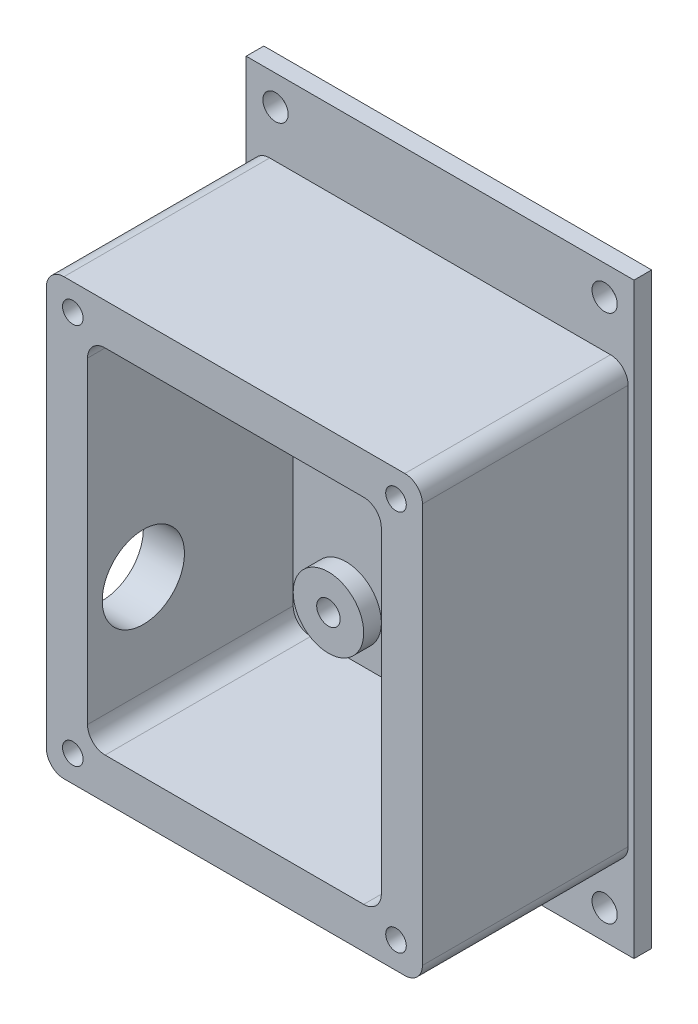
from build123d import *

# Parameters (mm, degrees)
SKICA1_W                    = 50
SKICA1_H                    = 60
P_IDAT_VYSUNUT_M2_DEPTH     = 3
SKICA3_W                    = 64
SKICA3_H                    = 74
SKICA3_W_2                  = 50
SKICA3_H_2                  = 60
VYSUNOUT_TENKOST_NN_1_DEPTH = 35
SKICA4_W                    = 66
SKICA4_H                    = 100
SKICA4_R                    = 2.15
SKICA4_W_2                  = 50
SKICA4_H_2                  = 60
P_IDAT_VYSUNUT_M5_DEPTH     = 3
SKICA2_R                    = 6
SKICA2_R_2                  = 2
VYSUNOUT_TENKOST_NN_2_DEPTH = 3
ZAOBLIT2_R                  = 3
ODEBRAT_VYSUNUT_M3_REACH    = 107.868
SKICA9_R                    = 7
ZAOBLIT4_R                  = 3
ZAOBLIT5_R                  = 3
ZAOBLIT6_R                  = 3
ZAOBLIT7_R                  = 3
SKICA10_R                   = 1.75
ODEBRAT_VYSUNUT_M4_DEPTH    = 30


with BuildPart() as part:
    # Skica1 → Přidat vysunutím2 (new body)
    with BuildSketch(Plane.XY):
        with Locations((25, 30)):
            Rectangle(SKICA1_W, SKICA1_H)
    extrude(amount=P_IDAT_VYSUNUT_M2_DEPTH)



with BuildPart() as body_2:
    # Skica3 → Vysunout tenkostěnný1 (new body)
    with BuildSketch(Plane.XY.offset(3)):
        with Locations((25, 30)):
            Rectangle(SKICA3_W, SKICA3_H)
        with Locations((25, 30)):
            Rectangle(SKICA3_W_2, SKICA3_H_2, mode=Mode.SUBTRACT)
    extrude(amount=VYSUNOUT_TENKOST_NN_1_DEPTH)


with BuildPart() as part_1:
    add(part.part)

    add(body_2.part)  # Přidat vysunutím5 merges body 2
    # Skica4 → Přidat vysunutím5 (add)
    with BuildSketch(Plane(origin=(0, 0, 0), x_dir=(-1, 0, 0), z_dir=(0, 0, -1))):
        with Locations((-25, 30)):
            Rectangle(SKICA4_W, SKICA4_H)
        with Locations((-53, 75)):
            Circle(SKICA4_R, mode=Mode.SUBTRACT)
        with Locations((3, 75)):
            Circle(SKICA4_R, mode=Mode.SUBTRACT)
        with Locations((3, -15)):
            Circle(SKICA4_R, mode=Mode.SUBTRACT)
        with Locations((-53, -15)):
            Circle(SKICA4_R, mode=Mode.SUBTRACT)
        with Locations((-25, 30)):
            Rectangle(SKICA4_W_2, SKICA4_H_2, mode=Mode.SUBTRACT)
    extrude(amount=-P_IDAT_VYSUNUT_M5_DEPTH)

    # Skica2 → Vysunout tenkostěnný2 (add)
    # profile 1 of 4: a face of its own
    with BuildSketch(Plane.XY.offset(3)):
        with Locations((9, 53)):
            Circle(SKICA2_R)
        with Locations((9, 53)):
            Circle(SKICA2_R_2, mode=Mode.SUBTRACT)
    # profile 2 of 4: a face of its own
    with BuildSketch(Plane.XY.offset(3)):
        with Locations((35, 53)):
            Circle(SKICA2_R)
        with Locations((35, 53)):
            Circle(SKICA2_R_2, mode=Mode.SUBTRACT)
    # profile 3 of 4: a face of its own
    with BuildSketch(Plane.XY.offset(3)):
        with Locations((35, 8)):
            Circle(SKICA2_R)
        with Locations((35, 8)):
            Circle(SKICA2_R_2, mode=Mode.SUBTRACT)
    # profile 4 of 4: a face of its own
    with BuildSketch(Plane.XY.offset(3)):
        with Locations((9, 8)):
            Circle(SKICA2_R)
        with Locations((9, 8)):
            Circle(SKICA2_R_2, mode=Mode.SUBTRACT)
    extrude(amount=VYSUNOUT_TENKOST_NN_2_DEPTH)

    # Zaoblit2
    zaoblit2_edges = [part_1.edges().sort_by_distance(p)[0] for p in [
        (-7, 67, 20.5),
        (-7, -7, 20.5),
        (57, -7, 20.5),
        (57, 67, 20.5),
    ]]
    fillet(zaoblit2_edges, radius=ZAOBLIT2_R)

    # Skica9 → Odebrat vysunutím3 (cut, up to next)
    with BuildSketch(Plane(origin=(0, 0, 0), x_dir=(0, 0, -1), z_dir=(1, 0, 0)), mode=Mode.PRIVATE) as odebrat_vysunut_m3_sk1:
        with Locations((-28.5, 20)):
            Circle(SKICA9_R)
    odebrat_vysunut_m3_tool1 = extrude(odebrat_vysunut_m3_sk1.sketch, amount=-ODEBRAT_VYSUNUT_M3_REACH, mode=Mode.PRIVATE) & part_1.part
    add(odebrat_vysunut_m3_tool1.solids().sort_by_distance((0, 20, 28.5))[0], mode=Mode.SUBTRACT)

    # Zaoblit4
    zaoblit4_edges = [part_1.edges().sort_by_distance(p)[0] for p in [
        (50, 60, 20.5),
    ]]
    fillet(zaoblit4_edges, radius=ZAOBLIT4_R)

    # Zaoblit5
    zaoblit5_edges = [part_1.edges().sort_by_distance(p)[0] for p in [
        (50, 0, 20.5),
    ]]
    fillet(zaoblit5_edges, radius=ZAOBLIT5_R)

    # Zaoblit6
    zaoblit6_edges = [part_1.edges().sort_by_distance(p)[0] for p in [
        (0, 0, 20.5),
    ]]
    fillet(zaoblit6_edges, radius=ZAOBLIT6_R)

    # Zaoblit7
    zaoblit7_edges = [part_1.edges().sort_by_distance(p)[0] for p in [
        (0, 60, 20.5),
    ]]
    fillet(zaoblit7_edges, radius=ZAOBLIT7_R)

    # Skica10 → Odebrat vysunutím4 (cut)
    with BuildSketch(Plane.XY.offset(38)):
        with Locations((-2.5, 62.5)):
            Circle(SKICA10_R)
        with Locations((52.5, 62.5)):
            Circle(SKICA10_R)
        with Locations((52.5, -2.5)):
            Circle(SKICA10_R)
        with Locations((-2.5, -2.5)):
            Circle(SKICA10_R)
    extrude(amount=-ODEBRAT_VYSUNUT_M4_DEPTH, mode=Mode.SUBTRACT)


solid = part_1.part
